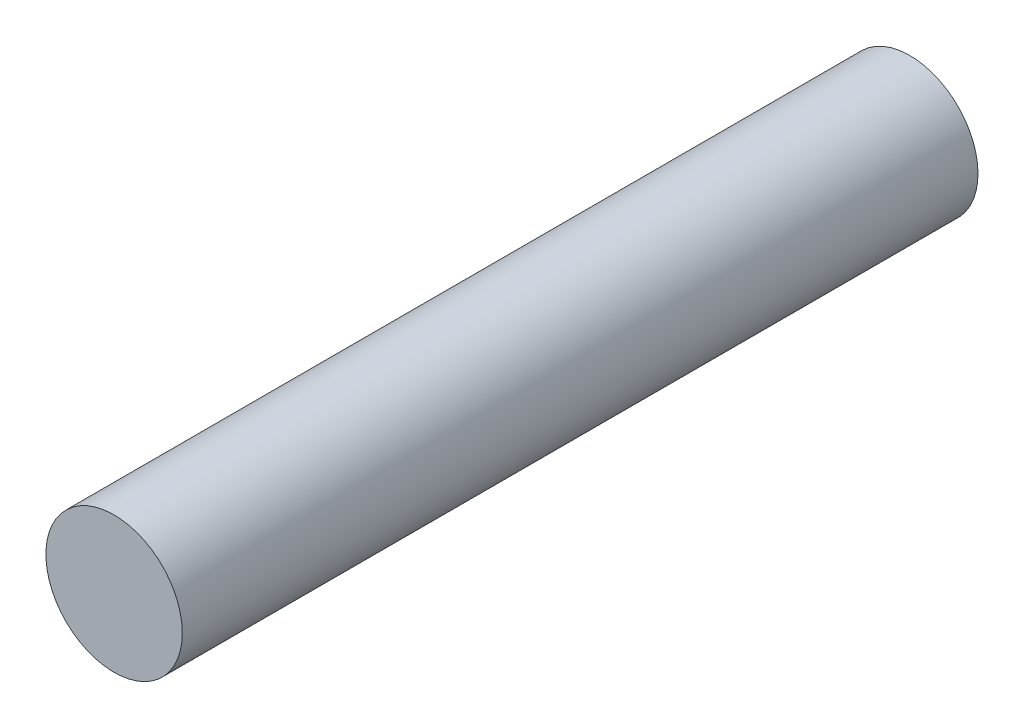
from build123d import *

# Parameters (mm, degrees)
SKETCH1_R           = 3
BOSS_EXTRUDE1_DEPTH = 35


with BuildPart() as part:
    # Sketch1 → Boss-Extrude1 (new body)
    with BuildSketch(Plane.XY):
        Circle(SKETCH1_R)
    extrude(amount=BOSS_EXTRUDE1_DEPTH)


solid = part.part
